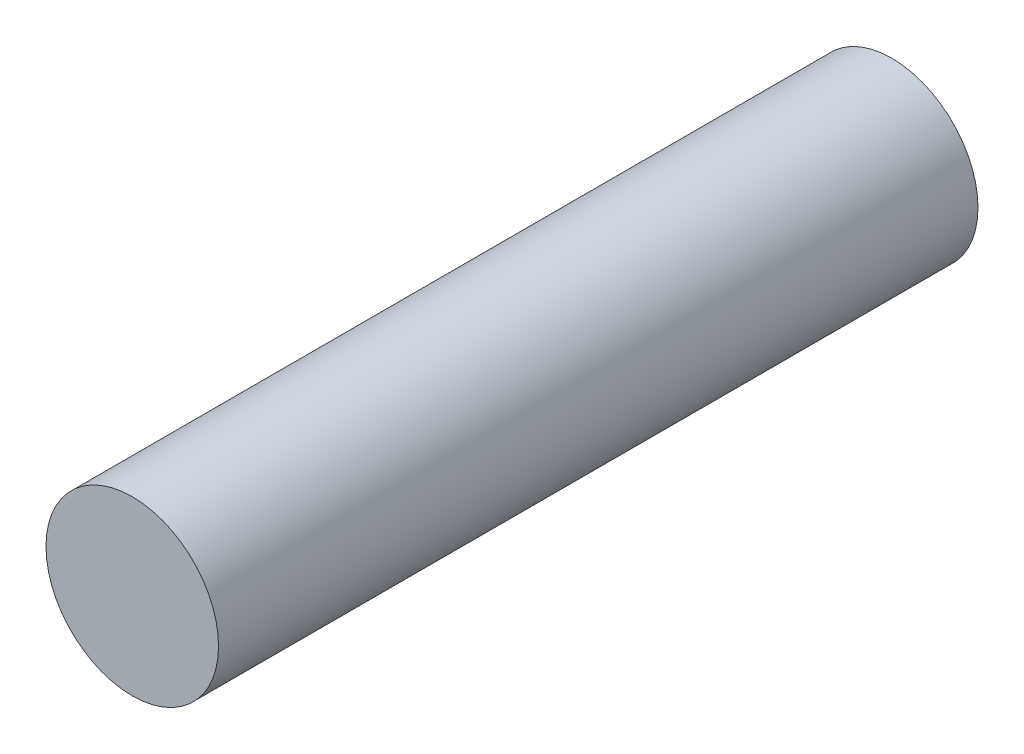
from build123d import *

# Parameters (mm, degrees)
SKETCH2_R           = 3.975
BOSS_EXTRUDE1_DEPTH = 35


with BuildPart() as part:
    # Sketch2 → Boss-Extrude1 (new body)
    with BuildSketch(Plane.XY):
        Circle(SKETCH2_R)
    extrude(amount=BOSS_EXTRUDE1_DEPTH)


solid = part.part
